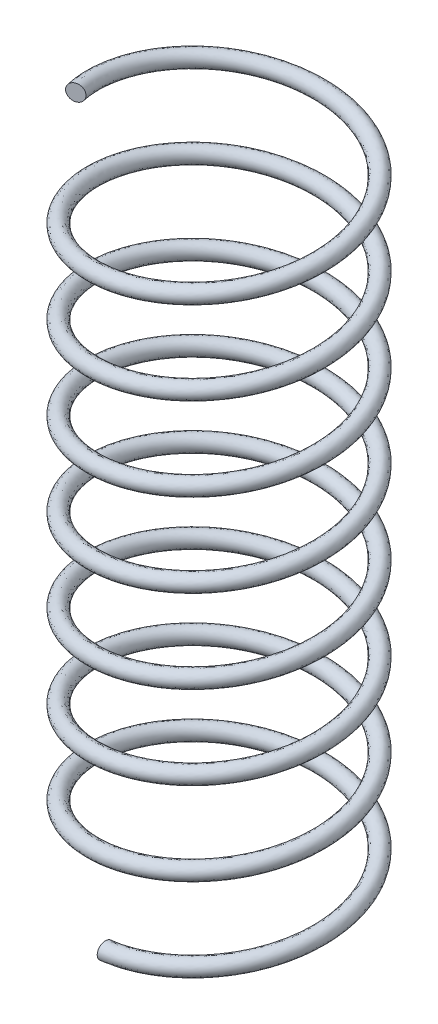
from build123d import *

# Parameters (mm, degrees)
SWEEP1_PITCH  = 6.512820513
SWEEP1_HEIGHT = 50.8
SWEEP1_RADIUS = 8.89
SKETCH2_R     = 0.635


with BuildPart() as part:
    # Sweep1: sweep along a helix
    with BuildLine() as sweep1_path:
        Helix(SWEEP1_PITCH, SWEEP1_HEIGHT, SWEEP1_RADIUS, center=(0, 0, 0), direction=(0, 1, 0))
    # Sketch2 → Sweep1 (sweep)
    with BuildSketch(Plane(origin=(0, 0, 0), x_dir=(0, 0, -1), z_dir=(1, 0, 0))):
        with Locations((-8.89, 0)):
            Circle(SKETCH2_R)
    sweep(path=sweep1_path.line, is_frenet=True)


solid = part.part
